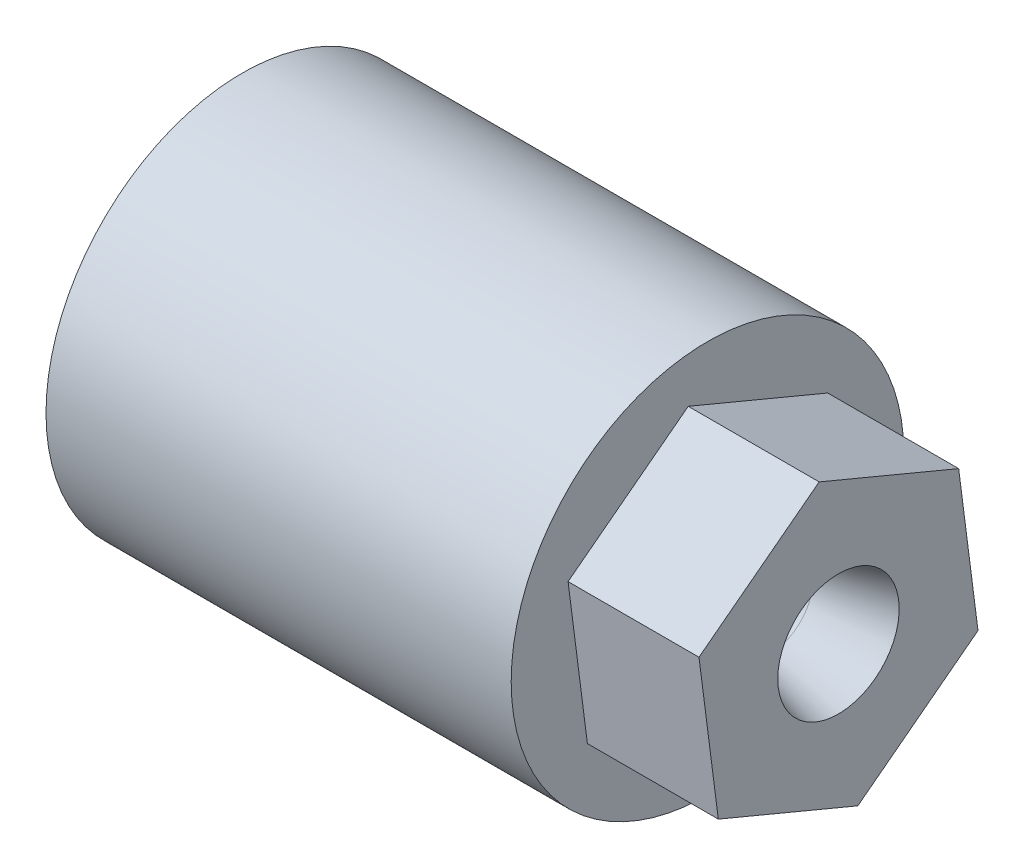
from build123d import *

# Parameters (mm, degrees)
CUT_EXTRUDE2_START = -6.35
SKETCH3_R          = 9.525
CUT_EXTRUDE2_DEPTH = 6.35


with BuildPart() as part:
    # Sketch1 → Revolve1 (revolve)
    with BuildSketch(Plane.XY, mode=Mode.PRIVATE) as revolve1_sk:
        with BuildLine():
            Line((0.21036812, 2.059695488), (3.51305494, 2.944647755))
            Line((3.51305494, 2.944647755), (3.51305494, 9.525))
            Line((3.51305494, 9.525), (-9.18694506, 9.525))
            Line((-9.18694506, 9.525), (-25.4, 9.525))
            Line((-25.4, 9.525), (-25.4, 5.747363917))
            Line((-25.4, 5.747363917), (-6.293014916, 5.747363917))
            ThreePointArc((-6.293014916, 5.747363917), (-5.077995018, 5.505681433), (-4.047950886, 4.817427948))
            Line((-4.047950886, 4.817427948), (-2.155261469, 2.924738531))
            ThreePointArc((-2.155261469, 2.924738531), (-1.166419102, 2.264015185), (0, 2.032))
            ThreePointArc((0, 2.032), (0.106091689, 2.038953617), (0.21036812, 2.059695488))
        make_face()
    revolve(revolve1_sk.sketch.rotate(Axis((0, 0, 0), (1, 0, 0)), 90), axis=Axis((0, 0, 0), (1, 0, 0)))

    # Sketch3 → Cut-Extrude2 (cut)
    with BuildSketch(Plane(origin=(3.51305494, 0, 0), x_dir=(0, 0, -1), z_dir=(1, 0, 0)).offset(CUT_EXTRUDE2_START)):
        with Locations(Location((0, 0, 0), (0, 0, 180))):
            Circle(SKETCH3_R)
        Polygon((-5.829170486, -4.447932641), (0.937437419, -7.272176044), (6.766607905, -2.824243403), (5.829170486, 4.447932641), (-0.937437419, 7.272176044), (-6.766607905, 2.824243403), align=None, mode=Mode.SUBTRACT)
    extrude(amount=CUT_EXTRUDE2_DEPTH, mode=Mode.SUBTRACT)


solid = part.part
